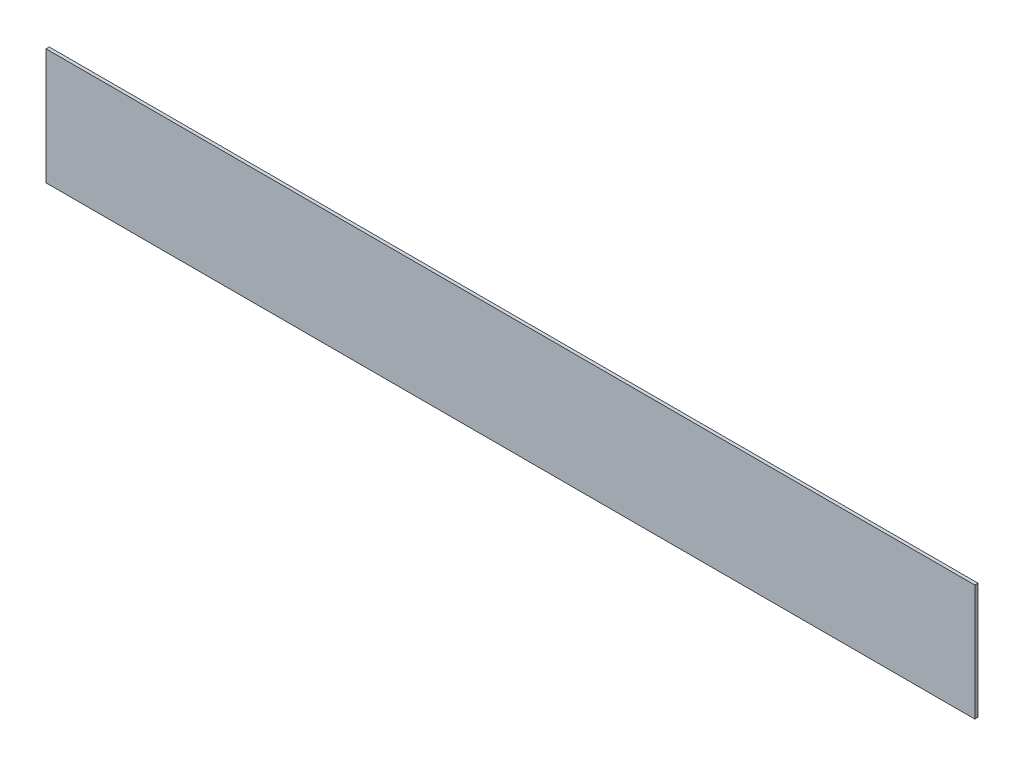
from build123d import *

# Parameters (mm, degrees)
SKETCH1_W           = 914.4
SKETCH1_H           = 114.3
BOSS_EXTRUDE1_DEPTH = 3.175


with BuildPart() as part:
    # Sketch1 → Boss-Extrude1 (new body)
    with BuildSketch(Plane.XY):
        with Locations((457.2, 57.15)):
            Rectangle(SKETCH1_W, SKETCH1_H)
    extrude(amount=BOSS_EXTRUDE1_DEPTH)


solid = part.part
